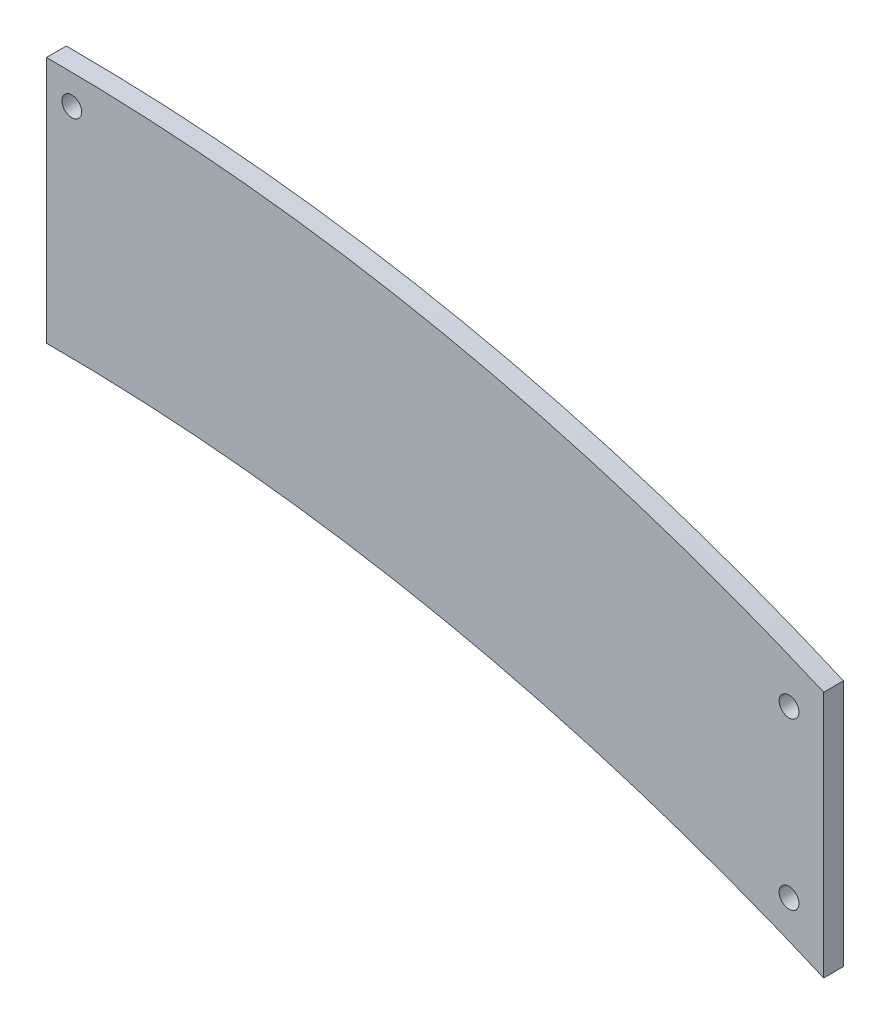
from build123d import *

# Parameters (mm, degrees)
SKETCH1_R           = 1
BOSS_EXTRUDE1_DEPTH = 2


with BuildPart() as part:
    # Sketch1 → Boss-Extrude1 (new body)
    with BuildSketch(Plane.XY):
        with BuildLine():
            Line((78.5, 24.233893723), (78.5, -0.766106277))
            ThreePointArc((78.5, -0.766106277), (40.084854178, 11.398625081), (0, 15.510629822))
            Line((0, 15.510629822), (0, 40.510629822))
            ThreePointArc((0, 40.510629822), (40.084854178, 36.398625081), (78.5, 24.233893723))
        make_face()
        with Locations((2.555188089, 37.510629822)):
            Circle(SKETCH1_R, mode=Mode.SUBTRACT)
        with Locations((75, 21.233893723)):
            Circle(SKETCH1_R, mode=Mode.SUBTRACT)
        with Locations((75, 4.5)):
            Circle(SKETCH1_R, mode=Mode.SUBTRACT)
    extrude(amount=BOSS_EXTRUDE1_DEPTH)


solid = part.part
